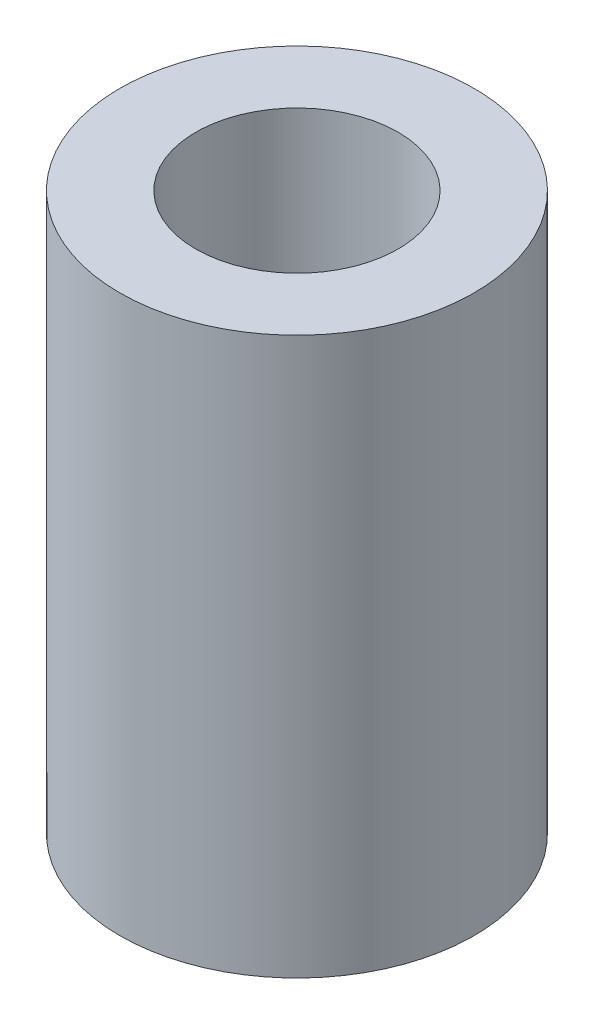
from build123d import *

# Parameters (mm, degrees)
SKETCH1_R           = 3.5
SKETCH1_R_2         = 2
BOSS_EXTRUDE1_DEPTH = 11


with BuildPart() as part:
    # Sketch1 → Boss-Extrude1 (new body)
    with BuildSketch(Plane(origin=(0, 0, 0), x_dir=(1, 0, 0), z_dir=(0, 1, 0))):
        with Locations(Location((0, 0, 0), (0, 0, 270))):
            Circle(SKETCH1_R)
        with Locations(Location((0, 0, 0), (0, 0, 270))):
            Circle(SKETCH1_R_2, mode=Mode.SUBTRACT)
    extrude(amount=BOSS_EXTRUDE1_DEPTH)


solid = part.part
